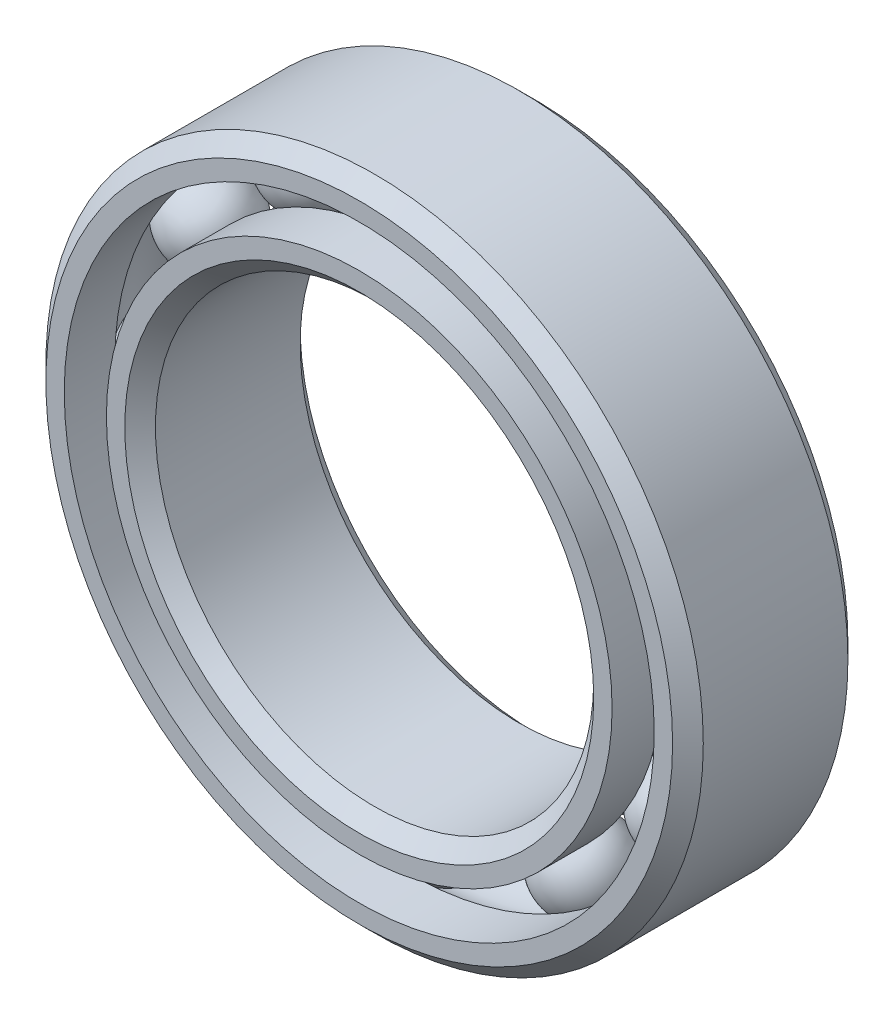
from build123d import *

# Parameters (mm, degrees)
CIRPATTERN1_COUNT = 12


with BuildPart() as part:
    # Sketch1 → Revolve1 (revolve)
    with BuildSketch(Plane(origin=(0, 0, 0), x_dir=(0, 0, -1), z_dir=(1, 0, 0))):
        with BuildLine():
            Line((1.65, 7.5), (-1.65, 7.5))
            Line((-1.65, 7.5), (-2, 7.15))
            Line((-2, 7.15), (-2, 6.73083963))
            Line((-2, 6.73083963), (-0.849284709, 6.73083963))
            ThreePointArc((-0.849284709, 6.73083963), (0, 7.225956591), (0.849284709, 6.73083963))
            Line((0.849284709, 6.73083963), (2, 6.73083963))
            Line((2, 6.73083963), (2, 7.15))
            Line((2, 7.15), (1.65, 7.5))
        make_face()
    revolve(axis=Axis((0, 0, 2), (0, 0, -1)))


with BuildPart() as body_2:
    # Sketch3 → Revolve3 (revolve)
    with BuildSketch(Plane(origin=(0, 0, 0), x_dir=(0, 0, -1), z_dir=(1, 0, 0))):
        with BuildLine():
            Line((-2, 5.76916037), (-0.849284709, 5.76916037))
            ThreePointArc((-0.849284709, 5.76916037), (0, 5.274043409), (0.849284709, 5.76916037))
            Line((0.849284709, 5.76916037), (2, 5.76916037))
            Line((2, 5.76916037), (2, 5.35))
            Line((2, 5.35), (1.65, 5))
            Line((1.65, 5), (-1.65, 5))
            Line((-1.65, 5), (-2, 5.35))
            Line((-2, 5.35), (-2, 5.76916037))
        make_face()
    revolve(axis=Axis((0, 0, 2), (0, 0, -1)))


with BuildPart() as body_3:
    # Sketch4 → Revolve4 (revolve)
    with BuildSketch(Plane(origin=(0, 0, 0), x_dir=(0, 0, -1), z_dir=(1, 0, 0))):
        with BuildLine():
            Line((-0.975956591, 6.25), (0.975956591, 6.25))
            ThreePointArc((0.975956591, 6.25), (0, 7.225956591), (-0.975956591, 6.25))
        make_face()
    revolve(axis=Axis((0, 6.25, 0.975956591), (0, 0, -1)))


with BuildPart() as cirpattern1_1:
    # CirPattern1: pattern copy
    add(body_3.part.rotate(Axis((0, 0, -2), (0, 0, 1)), 1 * 360 / CIRPATTERN1_COUNT))


with BuildPart() as cirpattern1_2:
    # CirPattern1: pattern copy
    add(body_3.part.rotate(Axis((0, 0, -2), (0, 0, 1)), 2 * 360 / CIRPATTERN1_COUNT))


with BuildPart() as cirpattern1_3:
    # CirPattern1: pattern copy
    add(body_3.part.rotate(Axis((0, 0, -2), (0, 0, 1)), 3 * 360 / CIRPATTERN1_COUNT))


with BuildPart() as cirpattern1_4:
    # CirPattern1: pattern copy
    add(body_3.part.rotate(Axis((0, 0, -2), (0, 0, 1)), 4 * 360 / CIRPATTERN1_COUNT))


with BuildPart() as cirpattern1_5:
    # CirPattern1: pattern copy
    add(body_3.part.rotate(Axis((0, 0, -2), (0, 0, 1)), 5 * 360 / CIRPATTERN1_COUNT))


with BuildPart() as cirpattern1_6:
    # CirPattern1: pattern copy
    add(body_3.part.rotate(Axis((0, 0, -2), (0, 0, 1)), 6 * 360 / CIRPATTERN1_COUNT))


with BuildPart() as cirpattern1_7:
    # CirPattern1: pattern copy
    add(body_3.part.rotate(Axis((0, 0, -2), (0, 0, 1)), 7 * 360 / CIRPATTERN1_COUNT))


with BuildPart() as cirpattern1_8:
    # CirPattern1: pattern copy
    add(body_3.part.rotate(Axis((0, 0, -2), (0, 0, 1)), 8 * 360 / CIRPATTERN1_COUNT))


with BuildPart() as cirpattern1_9:
    # CirPattern1: pattern copy
    add(body_3.part.rotate(Axis((0, 0, -2), (0, 0, 1)), 9 * 360 / CIRPATTERN1_COUNT))


with BuildPart() as cirpattern1_10:
    # CirPattern1: pattern copy
    add(body_3.part.rotate(Axis((0, 0, -2), (0, 0, 1)), 10 * 360 / CIRPATTERN1_COUNT))


with BuildPart() as cirpattern1_11:
    # CirPattern1: pattern copy
    add(body_3.part.rotate(Axis((0, 0, -2), (0, 0, 1)), 11 * 360 / CIRPATTERN1_COUNT))


solid = Compound([part.part, body_2.part, body_3.part, cirpattern1_1.part, cirpattern1_2.part, cirpattern1_3.part, cirpattern1_4.part, cirpattern1_5.part, cirpattern1_6.part, cirpattern1_7.part, cirpattern1_8.part, cirpattern1_9.part, cirpattern1_10.part, cirpattern1_11.part])
